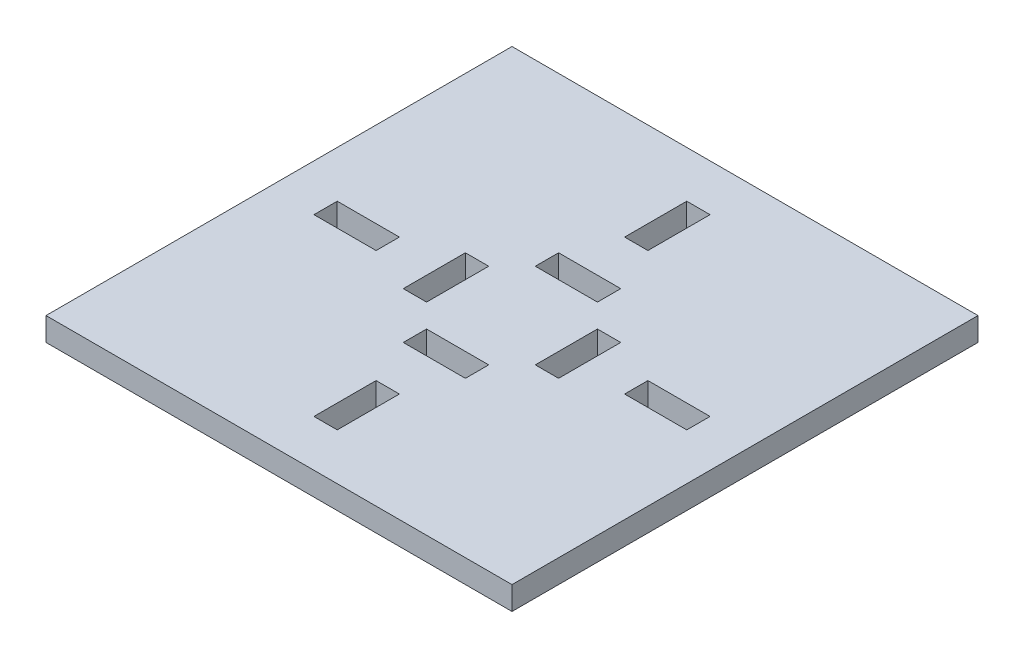
from build123d import *

# Parameters (mm, degrees)
CROQUIS1_W              = 60
CROQUIS1_H              = 60
SALIENTE_EXTRUIR1_DEPTH = 3


with BuildPart() as part:
    # Croquis1 → Saliente-Extruir1 (new body)
    with BuildSketch(Plane(origin=(0, 0, 0), x_dir=(1, 0, 0), z_dir=(0, 1, 0))):
        Rectangle(CROQUIS1_W, CROQUIS1_H)
        Polygon((0, 10), (-4, 10), (-4, 7), (4, 7), (4, 10), align=None, mode=Mode.SUBTRACT)
        Polygon((7, 4), (7, -4), (10, -4), (10, 0), (10, 4), align=None, mode=Mode.SUBTRACT)
        Polygon((4, -7), (-4, -7), (-4, -10), (0, -10), (4, -10), align=None, mode=Mode.SUBTRACT)
        Polygon((-7, -4), (-7, 4), (-10, 4), (-10, 0), (-10, -4), align=None, mode=Mode.SUBTRACT)
        Polygon((20, 1.5), (16, 1.5), (16, -1.5), (24, -1.5), (24, 1.5), align=None, mode=Mode.SUBTRACT)
        Polygon((1.5, -20), (1.5, -16), (-1.5, -16), (-1.5, -24), (1.5, -24), align=None, mode=Mode.SUBTRACT)
        Polygon((-20, -1.5), (-16, -1.5), (-16, 1.5), (-24, 1.5), (-24, -1.5), align=None, mode=Mode.SUBTRACT)
        Polygon((-1.5, 20), (-1.5, 16), (1.5, 16), (1.5, 24), (-1.5, 24), align=None, mode=Mode.SUBTRACT)
    extrude(amount=SALIENTE_EXTRUIR1_DEPTH)


solid = part.part
